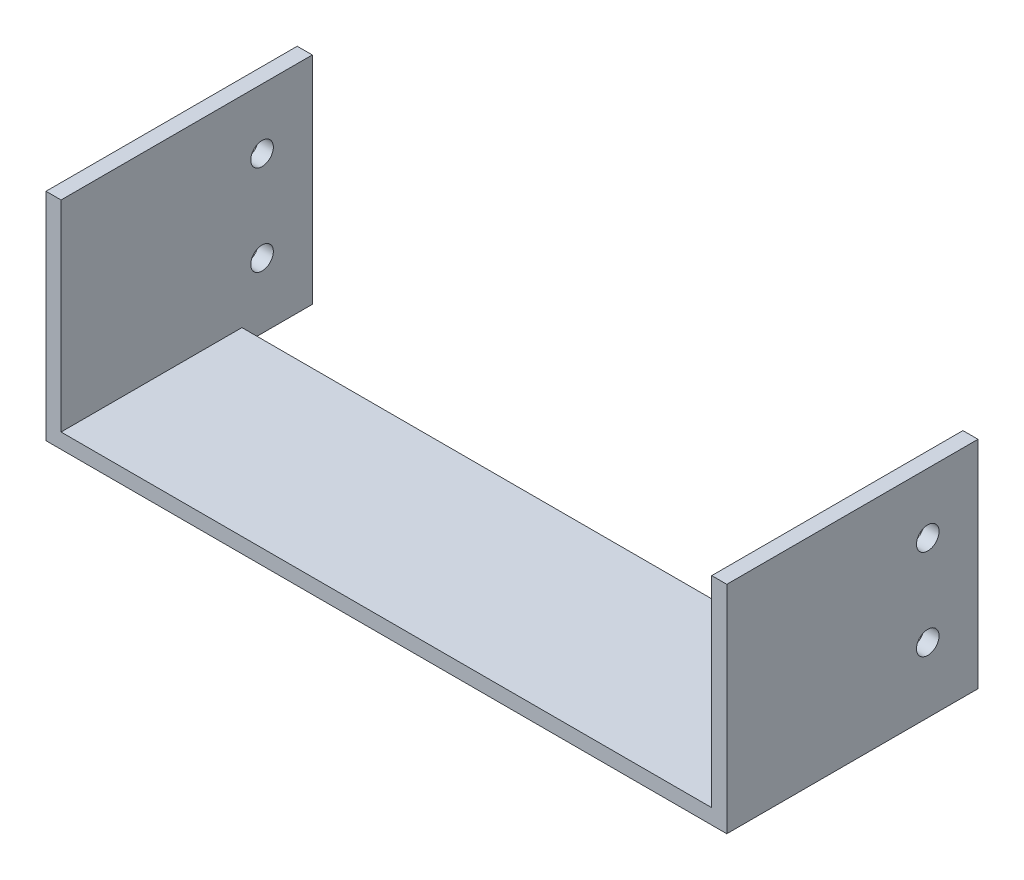
from build123d import *

# Parameters (mm, degrees)
SKETCH1_W           = 129.5
SKETCH1_H           = 36
BOSS_EXTRUDE1_DEPTH = 3
SKETCH2_W           = 50
SKETCH2_H           = 43
SKETCH2_R           = 2.25
BOSS_EXTRUDE2_DEPTH = 3


with BuildPart() as part:
    # Sketch1 → Boss-Extrude1 (new body)
    with BuildSketch(Plane(origin=(0, 0, 0), x_dir=(1, 0, 0), z_dir=(0, 1, 0))):
        with Locations((64.75, 18)):
            Rectangle(SKETCH1_W, SKETCH1_H)
    extrude(amount=BOSS_EXTRUDE1_DEPTH)

    # Sketch2 → Boss-Extrude2 (add)
    with BuildSketch(Plane(origin=(129.5, 0, 0), x_dir=(0, 0, -1), z_dir=(1, 0, 0))):
        with Locations((25, 21.5)):
            Rectangle(SKETCH2_W, SKETCH2_H)
        with Locations((40, 31)):
            Circle(SKETCH2_R, mode=Mode.SUBTRACT)
        with Locations((40, 13)):
            Circle(SKETCH2_R, mode=Mode.SUBTRACT)
    boss_extrude2 = extrude(amount=BOSS_EXTRUDE2_DEPTH)

    # Mirror1: Boss-Extrude2 across plane
    add(boss_extrude2.mirror(Plane(origin=(64.75, 0, 0), x_dir=(0, 0, 1), z_dir=(1, 0, 0))))


solid = part.part
